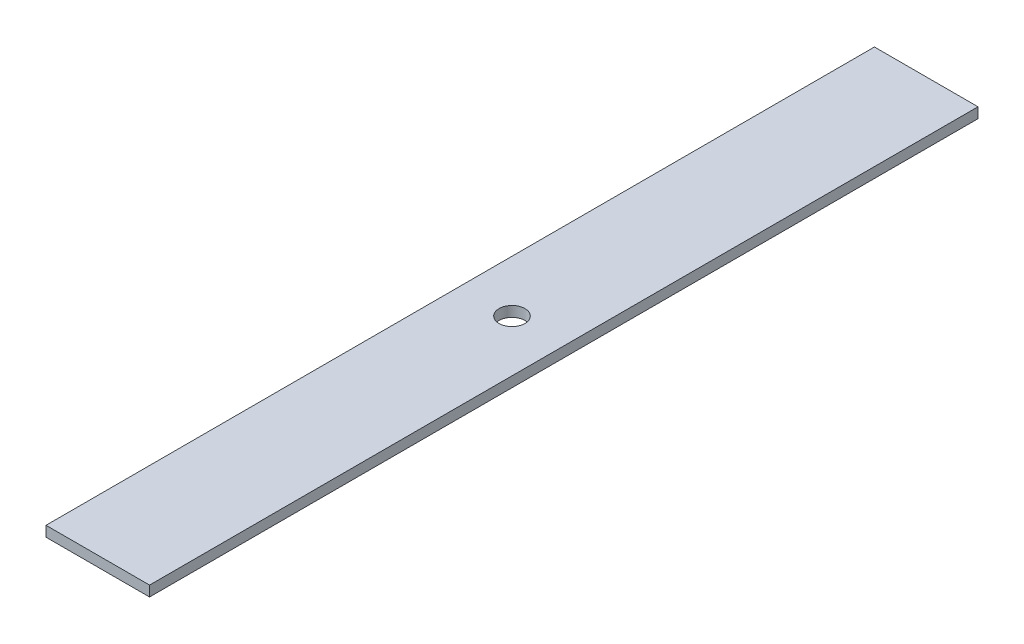
from build123d import *

# Parameters (mm, degrees)
SKETCH_W            = 25.4
SKETCH_H            = 203.2
SKETCH_R            = 3.175
BOSS_EXTRUDE2_DEPTH = 2.54


with BuildPart() as part:
    # sketch → Boss-Extrude2 (new body)
    with BuildSketch(Plane(origin=(0, 0, 0), x_dir=(1, 0, 0), z_dir=(0, 1, 0))):
        with Locations((12.7, 101.6)):
            Rectangle(SKETCH_W, SKETCH_H)
        with Locations(Location((12.7, 101.6, 0), (0, 0, 270))):
            Circle(SKETCH_R, mode=Mode.SUBTRACT)
    extrude(amount=BOSS_EXTRUDE2_DEPTH)


solid = part.part
